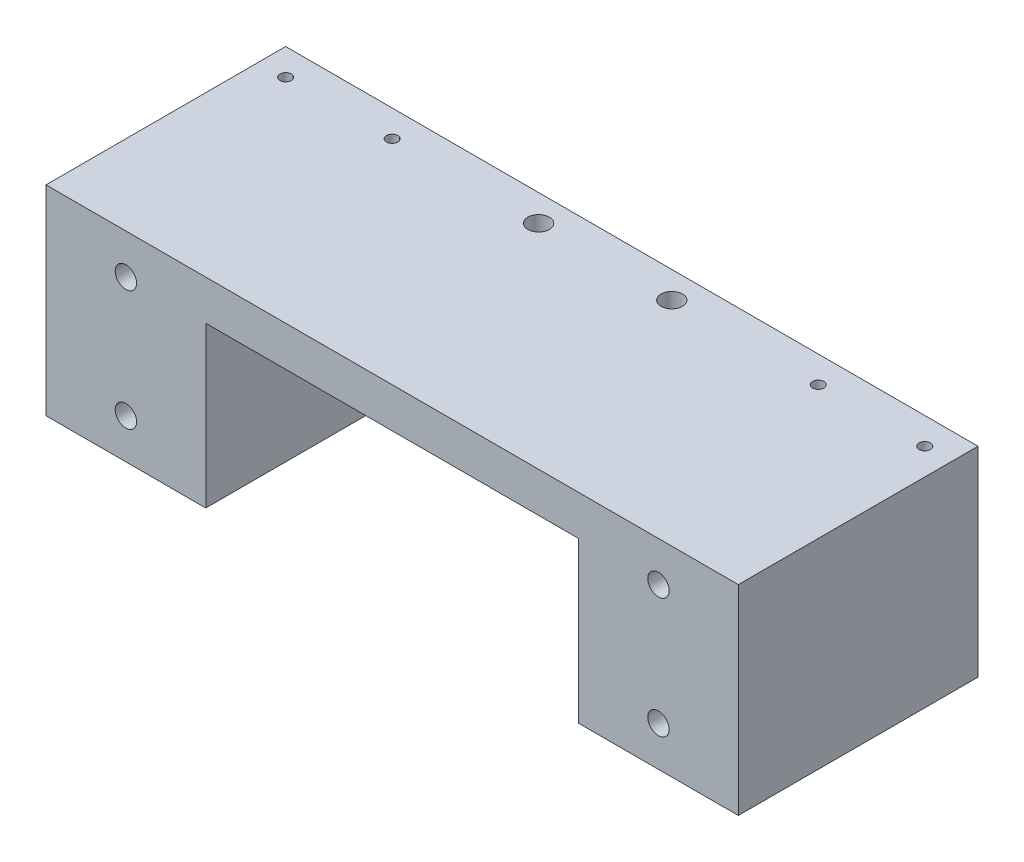
from build123d import *

# Parameters (mm, degrees)
SKETCH1_W                                      = 165.1
SKETCH1_H                                      = 228.6
BOSS_EXTRUDE1_DEPTH                            = 19.05
SKETCH2_W                                      = 76.2
SKETCH2_H                                      = 203.2
CUT_EXTRUDE1_DEPTH                             = 143.27401379
SKETCH3_W                                      = 165.1
SKETCH3_H                                      = 9.525
BOSS_EXTRUDE2_DEPTH                            = 57.15
SKETCH4_W                                      = 19.05
SKETCH4_H                                      = 38.1
BOSS_EXTRUDE3_DEPTH                            = 12.7
SKETCH7_W                                      = 88.9
SKETCH7_H                                      = 12.7
BOSS_EXTRUDE4_DEPTH                            = 19.05
SKETCH8_W                                      = 82.55
SKETCH8_H                                      = 19.05
CUT_EXTRUDE4_DEPTH                             = 2.54
F_8_32_TAPPED_HOLE1_D                          = 3.4544
F_8_32_TAPPED_HOLE1_DEPTH                      = 12.7
F_8_32_TAPPED_HOLE1_TIP                        = 1.037806461
F_1_4_CLEARANCE_HOLE1_D                        = 6.7564
F_1_4_CLEARANCE_HOLE1_DEPTH                    = 10.16
CBORE_FOR_8_SOCKET_HEAD_CAP_SCREW1_D           = 4.4958
CBORE_FOR_8_SOCKET_HEAD_CAP_SCREW1_CBORE_D     = 7.9375
CBORE_FOR_8_SOCKET_HEAD_CAP_SCREW1_CBORE_DEPTH = 4.1656
F_1_4_20_TAPPED_HOLE1_D                        = 5.1054
BOSS_EXTRUDE5_START                            = -7.9375
SKETCH22_W                                     = 6.35
SKETCH22_H                                     = 6.35
BOSS_EXTRUDE5_DEPTH                            = 3.175
SKETCH23_R                                     = 1.5875
CUT_EXTRUDE5_DEPTH                             = 3.175
SKETCH27_W                                     = 57.15
SKETCH27_H                                     = 47.685786878
BOSS_EXTRUDE6_DEPTH                            = 38.1
SKETCH26_W                                     = 19.05
SKETCH26_H                                     = 228.6
CUT_EXTRUDE7_DEPTH                             = 246.442080744
SKETCH29_W                                     = 1.35255
SKETCH29_H                                     = 47.685786878
F_6_32_TAPPED_HOLE1_AT_2_COUNT                 = 2
F_6_32_TAPPED_HOLE1_AT_2_PITCH                 = 25.4
F_6_32_TAPPED_HOLE1_AT_3_COUNT                 = 2
F_6_32_TAPPED_HOLE1_AT_3_PITCH                 = 127
F_6_32_TAPPED_HOLE1_AT_4_COUNT                 = 2
F_6_32_TAPPED_HOLE1_AT_4_PITCH                 = 152.4
SKETCH31_W                                     = 2.5527
SKETCH31_H                                     = 57.15
F_1_4_20_TAPPED_HOLE2_AT_2_COUNT               = 2
F_1_4_20_TAPPED_HOLE2_AT_2_PITCH               = 28.635786878
F_1_4_20_TAPPED_HOLE2_AT_3_COUNT               = 2
F_1_4_20_TAPPED_HOLE2_AT_3_PITCH               = 127
F_1_4_20_TAPPED_HOLE2_AT_4_COUNT               = 2
F_1_4_20_TAPPED_HOLE2_AT_4_PITCH               = 130.188356968


with BuildPart() as part:
    # Sketch1 → Boss-Extrude1 (new body)
    with BuildSketch(Plane.XY):
        Rectangle(SKETCH1_W, SKETCH1_H)
    extrude(amount=BOSS_EXTRUDE1_DEPTH)

    # Sketch2 → Cut-Extrude1 (cut, through all)
    with BuildSketch(Plane.XY.offset(19.05)):
        with Locations((0, -12.7)):
            Rectangle(SKETCH2_W, SKETCH2_H)
    extrude(amount=-CUT_EXTRUDE1_DEPTH, mode=Mode.SUBTRACT)

    # Sketch3 → Boss-Extrude2 (add)
    with BuildSketch(Plane(origin=(0, 0, 0), x_dir=(-1, 0, 0), z_dir=(0, 0, -1))):
        with Locations((0, 109.5375)):
            Rectangle(SKETCH3_W, SKETCH3_H)
    extrude(amount=BOSS_EXTRUDE2_DEPTH)

    # Sketch4 → Boss-Extrude3 (add)
    with BuildSketch(Plane(origin=(0, 0, -57.15), x_dir=(-1, 0, 0), z_dir=(0, 0, -1))):
        with Locations((-73.025, 85.725)):
            Rectangle(SKETCH4_W, SKETCH4_H)
    boss_extrude3 = extrude(amount=-BOSS_EXTRUDE3_DEPTH)

    # Mirror1: Boss-Extrude3 across plane
    add(boss_extrude3.mirror(Plane(origin=(0, 0, 0), x_dir=(0, 0, 1), z_dir=(1, 0, 0))))

    # Sketch7 → Boss-Extrude4 (add)
    with BuildSketch(Plane.XY.offset(19.05)):
        with Locations((-60.325, -107.95)):
            Rectangle(SKETCH7_W, SKETCH7_H)
    boss_extrude4 = extrude(amount=-BOSS_EXTRUDE4_DEPTH)

    # Sketch8 → Cut-Extrude4 (cut)
    with BuildSketch(Plane(origin=(0, -114.3, 0), x_dir=(-1, 0, 0), z_dir=(0, -1, 0))):
        with Locations((60.325, -9.525)):
            Rectangle(SKETCH8_W, SKETCH8_H)
    cut_extrude4 = extrude(amount=-CUT_EXTRUDE4_DEPTH, mode=Mode.SUBTRACT)

    # Mirror3: Boss-Extrude4, Cut-Extrude4 across plane
    add(boss_extrude4.mirror(Plane(origin=(0, 0, 0), x_dir=(0, 0, 1), z_dir=(1, 0, 0))))
    add(cut_extrude4.mirror(Plane(origin=(0, 0, 0), x_dir=(0, 0, 1), z_dir=(1, 0, 0))), mode=Mode.SUBTRACT)

    # #8-32 Tapped Hole1
    with Locations(Plane(origin=(0, 114.3, 0), x_dir=(1, 0, 0), z_dir=(0, 1, 0))):
        with Locations((-76.2, -12.7), (-63.5, -12.7), (63.5, -12.7), (76.2, -12.7)):
            Hole(F_8_32_TAPPED_HOLE1_D / 2, depth=F_8_32_TAPPED_HOLE1_DEPTH)
            with Locations((0, 0, -(F_8_32_TAPPED_HOLE1_DEPTH + F_8_32_TAPPED_HOLE1_TIP / 2))):  # 118° drill point
                Cone(0, F_8_32_TAPPED_HOLE1_D / 2, F_8_32_TAPPED_HOLE1_TIP, mode=Mode.SUBTRACT)

    # 1/4 Clearance Hole1
    with Locations(Plane(origin=(0, -101.6, 0), x_dir=(1, 0, 0), z_dir=(0, 1, 0))):
        with Locations((-95.25, -6.35), (-25.4, -6.35), (25.4, -6.35), (95.25, -6.35)):
            Hole(F_1_4_CLEARANCE_HOLE1_D / 2, depth=F_1_4_CLEARANCE_HOLE1_DEPTH)

    # CBORE for #8 Socket Head Cap Screw1 (through all)
    with Locations(Plane.XY.offset(19.05)):
        with Locations((-76.2, 9.525), (-44.45, 9.525), (44.45, 9.525), (76.2, 9.525)):
            CounterBoreHole(CBORE_FOR_8_SOCKET_HEAD_CAP_SCREW1_D / 2, CBORE_FOR_8_SOCKET_HEAD_CAP_SCREW1_CBORE_D / 2, CBORE_FOR_8_SOCKET_HEAD_CAP_SCREW1_CBORE_DEPTH)

    # 1/4-20 Tapped Hole1 (through all)
    with Locations(Plane(origin=(0, 114.3, 0), x_dir=(1, 0, 0), z_dir=(0, 1, 0))):
        with Locations((15.875, 50.8), (-15.875, 50.8)):
            Hole(F_1_4_20_TAPPED_HOLE1_D / 2)

    # Sketch27 → Boss-Extrude6 (add)
    with BuildSketch(Plane(origin=(82.55, 0, 0), x_dir=(0, 0, -1), z_dir=(1, 0, 0))):
        with Locations((28.575, 90.457106561)):
            Rectangle(SKETCH27_W, SKETCH27_H)
    boss_extrude6 = extrude(amount=-BOSS_EXTRUDE6_DEPTH)

    # Mirror4: Boss-Extrude6 across plane
    add(boss_extrude6.mirror(Plane(origin=(0, 0, 0), x_dir=(0, 0, 1), z_dir=(1, 0, 0))))

    # Sketch26 → Cut-Extrude7 (cut, through all)
    with BuildSketch(Plane(origin=(104.775, 0, 0), x_dir=(0, 0, -1), z_dir=(1, 0, 0))):
        with Locations((-9.525, 0)):
            Rectangle(SKETCH26_W, SKETCH26_H)
    extrude(amount=-CUT_EXTRUDE7_DEPTH, mode=Mode.SUBTRACT)

    # Sketch29 → #6-32 Tapped Hole1 (revolve, cut)
    with BuildSketch(Plane(origin=(-76.2, 114.3, -50.8), x_dir=(0, 0, 1), z_dir=(1, 0, 0))):
        with Locations((0.676275, 23.842893439)):
            Rectangle(SKETCH29_W, SKETCH29_H)
    f_6_32_tapped_hole1 = revolve(axis=Axis((-76.2, 120.65, -50.8), (0, -1, 0)), mode=Mode.SUBTRACT)

    # #6-32 Tapped Hole1 at 2: #6-32 Tapped Hole1 ×2
    with Locations(*[(i * F_6_32_TAPPED_HOLE1_AT_2_PITCH, 0, 0) for i in range(1, F_6_32_TAPPED_HOLE1_AT_2_COUNT)]):
        add(f_6_32_tapped_hole1, mode=Mode.SUBTRACT)

    # #6-32 Tapped Hole1 at 3: #6-32 Tapped Hole1 ×2
    with Locations(*[(i * F_6_32_TAPPED_HOLE1_AT_3_PITCH, 0, 0) for i in range(1, F_6_32_TAPPED_HOLE1_AT_3_COUNT)]):
        add(f_6_32_tapped_hole1, mode=Mode.SUBTRACT)

    # #6-32 Tapped Hole1 at 4: #6-32 Tapped Hole1 ×2
    with Locations(*[(i * F_6_32_TAPPED_HOLE1_AT_4_PITCH, 0, 0) for i in range(1, F_6_32_TAPPED_HOLE1_AT_4_COUNT)]):
        add(f_6_32_tapped_hole1, mode=Mode.SUBTRACT)

    # Sketch31 → 1/4-20 Tapped Hole2 (revolve, cut)
    with BuildSketch(Plane(origin=(-63.5, 104.775, 0), x_dir=(0, -1, 0), z_dir=(1, 0, 0))):
        with Locations((1.27635, 28.575)):
            Rectangle(SKETCH31_W, SKETCH31_H)
    f_1_4_20_tapped_hole2 = revolve(axis=Axis((-63.5, 104.775, 6.35), (0, 0, -1)), mode=Mode.SUBTRACT)

    # 1/4-20 Tapped Hole2 at 2: 1/4-20 Tapped Hole2 ×2
    with Locations(*[(0, -i * F_1_4_20_TAPPED_HOLE2_AT_2_PITCH, 0) for i in range(1, F_1_4_20_TAPPED_HOLE2_AT_2_COUNT)]):
        add(f_1_4_20_tapped_hole2, mode=Mode.SUBTRACT)

    # 1/4-20 Tapped Hole2 at 3: 1/4-20 Tapped Hole2 ×2
    with Locations(*[(i * F_1_4_20_TAPPED_HOLE2_AT_3_PITCH, 0, 0) for i in range(1, F_1_4_20_TAPPED_HOLE2_AT_3_COUNT)]):
        add(f_1_4_20_tapped_hole2, mode=Mode.SUBTRACT)

    # 1/4-20 Tapped Hole2 at 4: 1/4-20 Tapped Hole2 ×2
    with Locations(*[Vector(0.9755096612129927, -0.21995658862628414, 0) * (i * F_1_4_20_TAPPED_HOLE2_AT_4_PITCH) for i in range(1, F_1_4_20_TAPPED_HOLE2_AT_4_COUNT)]):
        add(f_1_4_20_tapped_hole2, mode=Mode.SUBTRACT)


with BuildPart() as body_2:
    # Sketch22 → Boss-Extrude5 (new body)
    with BuildSketch(Plane(origin=(0, 0, -57.15), x_dir=(-1, 0, 0), z_dir=(0, 0, -1)).offset(BOSS_EXTRUDE5_START)):
        with Locations((0, 101.6)):
            Rectangle(SKETCH22_W, SKETCH22_H)
    extrude(amount=BOSS_EXTRUDE5_DEPTH)

    # Sketch23 → Cut-Extrude5 (cut)
    with BuildSketch(Plane(origin=(0, 0, -52.3875), x_dir=(-1, 0, 0), z_dir=(0, 0, -1))):
        with Locations((0, 101.6)):
            Circle(SKETCH23_R)
    extrude(amount=-CUT_EXTRUDE5_DEPTH, mode=Mode.SUBTRACT)


solid = Compound([part.part, body_2.part])
